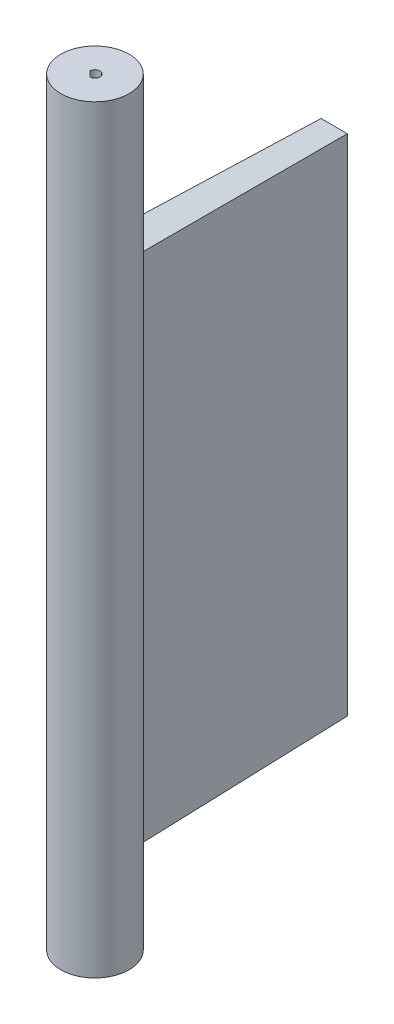
from build123d import *

# Parameters (mm, degrees)
SKIZZE2_R                       = 10
AUFSATZ_LINEAR_AUSTRAGEN1_DEPTH = 210
SKIZZE7_W                       = 10.134043554
SKIZZE7_H                       = 150
AUFSATZ_LINEAR_AUSTRAGEN2_DEPTH = 70
AUFSATZ_LINEAR_AUSTRAGEN2_DRAFT = -1
SKIZZE8_R                       = 10
AUFSATZ_LINEAR_AUSTRAGEN3_DEPTH = 12
SCHNITT_LINEAR_AUSTRAGEN1_DEPTH = 10


with BuildPart() as part:
    # Skizze2 → Aufsatz-Linear austragen1 (new body)
    with BuildSketch(Plane(origin=(0, 0, 0), x_dir=(1, 0, 0), z_dir=(0, 1, 0))):
        with Locations(Location((0, 0, 0), (0, 0, 270))):
            Circle(SKIZZE2_R)
    extrude(amount=AUFSATZ_LINEAR_AUSTRAGEN1_DEPTH)


with BuildPart() as aufsatz_linear_austragen2_tool:
    # Skizze7 → Aufsatz-Linear austragen2 (with draft: the straight prism first)
    with BuildSketch(Plane.XY):
        with Locations((0, 100)):
            Rectangle(SKIZZE7_W, SKIZZE7_H)
    extrude(amount=-AUFSATZ_LINEAR_AUSTRAGEN2_DEPTH)
    # Aufsatz-Linear austragen2: the draft: its side faces are tilted about the plane it starts from
    aufsatz_linear_austragen2_sides = [aufsatz_linear_austragen2_tool.faces().sort_by_distance(p)[0] for p in [
        (0, 175, -35),
        (-5.067021777, 100, -35),
        (0, 25, -35),
        (5.067021777, 100, -35),
    ]]
    draft(aufsatz_linear_austragen2_sides, Plane.XY, AUFSATZ_LINEAR_AUSTRAGEN2_DRAFT)


with BuildPart() as part_1:
    add(part.part)

    # Aufsatz-Linear austragen2: add aufsatz_linear_austragen2_tool
    add(aufsatz_linear_austragen2_tool.part)

    # Skizze8 → Aufsatz-Linear austragen3 (add)
    with BuildSketch(Plane(origin=(0, 210, 0), x_dir=(1, 0, 0), z_dir=(0, 1, 0))):
        with Locations(Location((0, 0, 0), (0, 0, 270))):
            Circle(SKIZZE8_R)
    extrude(amount=AUFSATZ_LINEAR_AUSTRAGEN3_DEPTH)

    # Skizze9 → Schnitt-Linear austragen1 (cut)
    with BuildSketch(Plane(origin=(0, 222, 0), x_dir=(1, 0, 0), z_dir=(0, 1, 0))):
        with BuildLine():
            Line((0, -1.5), (-1.5, 0))
            ThreePointArc((-1.5, 0), (1.060660172, 1.060660172), (0, -1.5))
        make_face()
    extrude(amount=-SCHNITT_LINEAR_AUSTRAGEN1_DEPTH, mode=Mode.SUBTRACT)


solid = part_1.part
